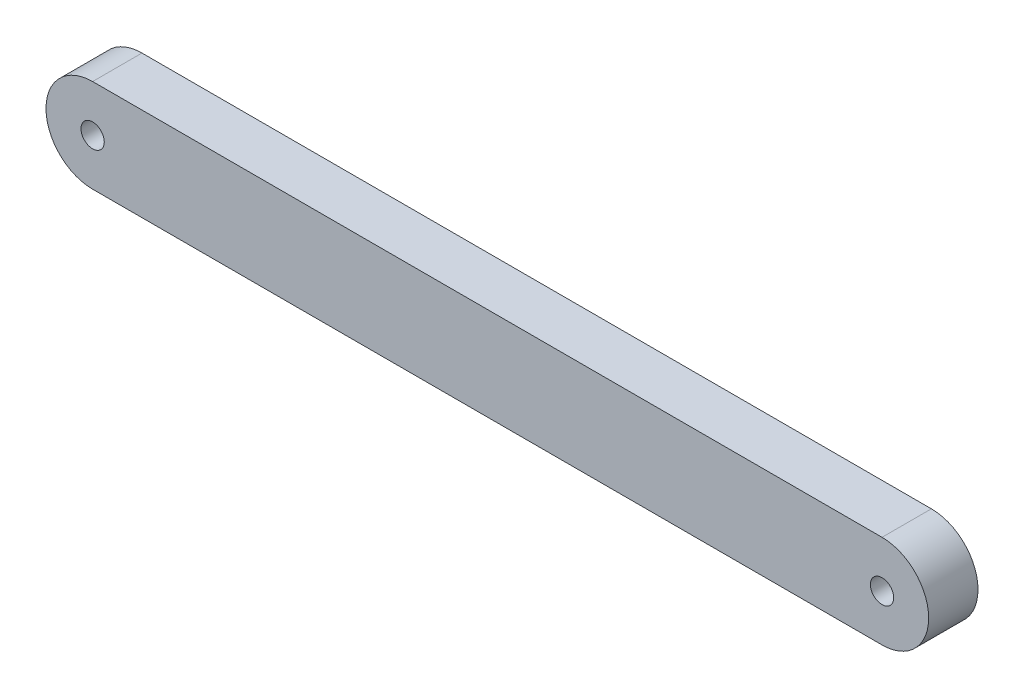
from build123d import *

# Parameters (mm, degrees)
BOSS_EXTRU_1_DEPTH      = 6.35
ESQUISSE2_R             = 1.5
ENL_V_MAT_EXTRU_1_DEPTH = 6.35
ESQUISSE3_R             = 1.5
ENL_V_MAT_EXTRU_2_DEPTH = 6.35


with BuildPart() as part:
    # Esquisse1 → Boss.-Extru.1 (new body)
    with BuildSketch(Plane.XY):
        with BuildLine():
            Line((0, 6), (101.6, 6))
            ThreePointArc((101.6, 6), (107.6, 0), (101.6, -6))
            Line((101.6, -6), (0, -6))
            ThreePointArc((0, -6), (-6, 0), (0, 6))
        make_face()
    extrude(amount=BOSS_EXTRU_1_DEPTH)

    # Esquisse2 → Enlèv. mat.-Extru.1 (cut)
    with BuildSketch(Plane.XY.offset(6.35)):
        Circle(ESQUISSE2_R)
    extrude(amount=-ENL_V_MAT_EXTRU_1_DEPTH, mode=Mode.SUBTRACT)

    # Esquisse3 → Enlèv. mat.-Extru.2 (cut)
    with BuildSketch(Plane.XY.offset(6.35)):
        with Locations((101.6, 0)):
            Circle(ESQUISSE3_R)
    extrude(amount=-ENL_V_MAT_EXTRU_2_DEPTH, mode=Mode.SUBTRACT)


solid = part.part
